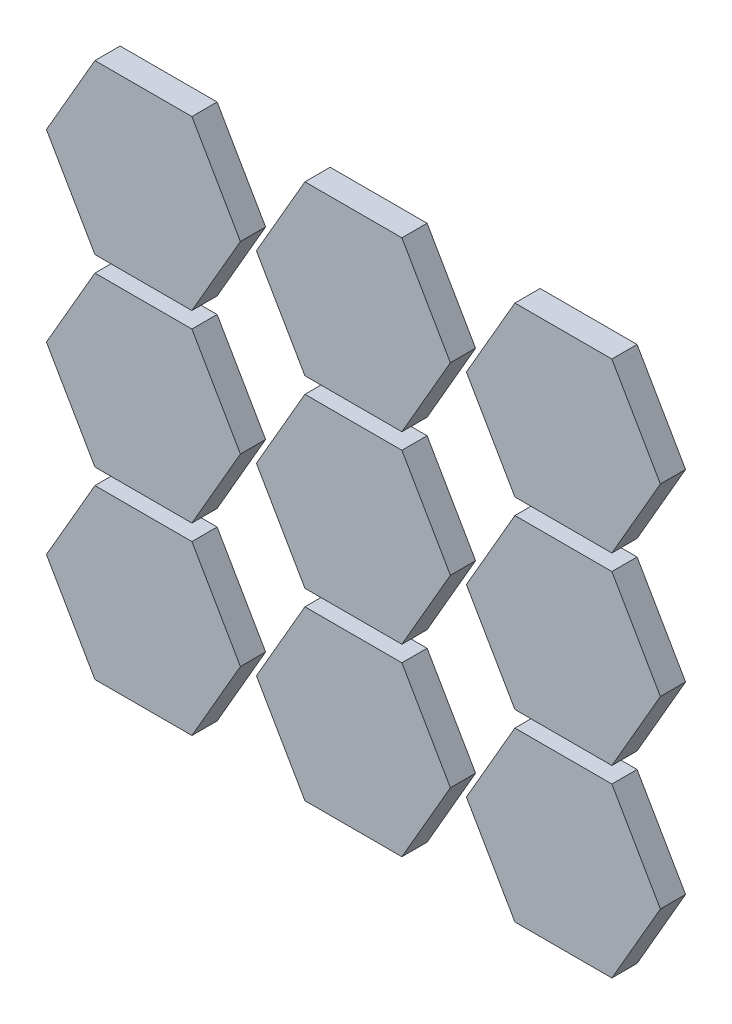
from build123d import *

# Parameters (mm, degrees)
BOSS_EXTRUDE1_DEPTH   = 3
BOSS_EXTRUDE1_2_DEPTH = 3
BOSS_EXTRUDE1_3_DEPTH = 3
BOSS_EXTRUDE1_4_DEPTH = 3
BOSS_EXTRUDE1_5_DEPTH = 3
BOSS_EXTRUDE1_6_DEPTH = 3
BOSS_EXTRUDE1_7_DEPTH = 3
BOSS_EXTRUDE1_8_DEPTH = 3
BOSS_EXTRUDE1_9_DEPTH = 3


with BuildPart() as part:
    # Sketch1 → Boss-Extrude1 (new body)
    with BuildSketch(Plane.XY):
        Polygon((30.773502692, -10), (36.547005384, 0), (30.773502692, 10), (19.226497308, 10), (13.452994616, 0), (19.226497308, -10), align=None)
    extrude(amount=BOSS_EXTRUDE1_DEPTH)


with BuildPart() as body_2:
    # Sketch1 → Boss-Extrude1 2 (new body)
    with BuildSketch(Plane.XY):
        Polygon((5.773502692, -10), (11.547005384, 0), (5.773502692, 10), (-5.773502692, 10), (-11.547005384, 0), (-5.773502692, -10), align=None)
    extrude(amount=BOSS_EXTRUDE1_2_DEPTH)


with BuildPart() as body_3:
    # Sketch1 → Boss-Extrude1 3 (new body)
    with BuildSketch(Plane.XY):
        Polygon((55.773502692, -10), (61.547005384, 0), (55.773502692, 10), (44.226497308, 10), (38.452994616, 0), (44.226497308, -10), align=None)
    extrude(amount=BOSS_EXTRUDE1_3_DEPTH)


with BuildPart() as body_4:
    # Sketch1 → Boss-Extrude1 4 (new body)
    with BuildSketch(Plane.XY):
        Polygon((30.773502692, 11.91), (36.547005384, 21.91), (30.773502692, 31.91), (19.226497308, 31.91), (13.452994616, 21.91), (19.226497308, 11.91), align=None)
    extrude(amount=BOSS_EXTRUDE1_4_DEPTH)


with BuildPart() as body_5:
    # Sketch1 → Boss-Extrude1 5 (new body)
    with BuildSketch(Plane.XY):
        Polygon((5.773502692, 11.91), (11.547005384, 21.91), (5.773502692, 31.91), (-5.773502692, 31.91), (-11.547005384, 21.91), (-5.773502692, 11.91), align=None)
    extrude(amount=BOSS_EXTRUDE1_5_DEPTH)


with BuildPart() as body_6:
    # Sketch1 → Boss-Extrude1 6 (new body)
    with BuildSketch(Plane.XY):
        Polygon((55.773502692, 11.91), (61.547005384, 21.91), (55.773502692, 31.91), (44.226497308, 31.91), (38.452994616, 21.91), (44.226497308, 11.91), align=None)
    extrude(amount=BOSS_EXTRUDE1_6_DEPTH)


with BuildPart() as body_7:
    # Sketch1 → Boss-Extrude1 7 (new body)
    with BuildSketch(Plane.XY):
        Polygon((30.773502692, 33.82), (36.547005384, 43.82), (30.773502692, 53.82), (19.226497308, 53.82), (13.452994616, 43.82), (19.226497308, 33.82), align=None)
    extrude(amount=BOSS_EXTRUDE1_7_DEPTH)


with BuildPart() as body_8:
    # Sketch1 → Boss-Extrude1 8 (new body)
    with BuildSketch(Plane.XY):
        Polygon((5.773502692, 33.82), (11.547005384, 43.82), (5.773502692, 53.82), (-5.773502692, 53.82), (-11.547005384, 43.82), (-5.773502692, 33.82), align=None)
    extrude(amount=BOSS_EXTRUDE1_8_DEPTH)


with BuildPart() as body_9:
    # Sketch1 → Boss-Extrude1 9 (new body)
    with BuildSketch(Plane.XY):
        Polygon((55.773502692, 33.82), (61.547005384, 43.82), (55.773502692, 53.82), (44.226497308, 53.82), (38.452994616, 43.82), (44.226497308, 33.82), align=None)
    extrude(amount=BOSS_EXTRUDE1_9_DEPTH)


solid = Compound([part.part, body_2.part, body_3.part, body_4.part, body_5.part, body_6.part, body_7.part, body_8.part, body_9.part])
